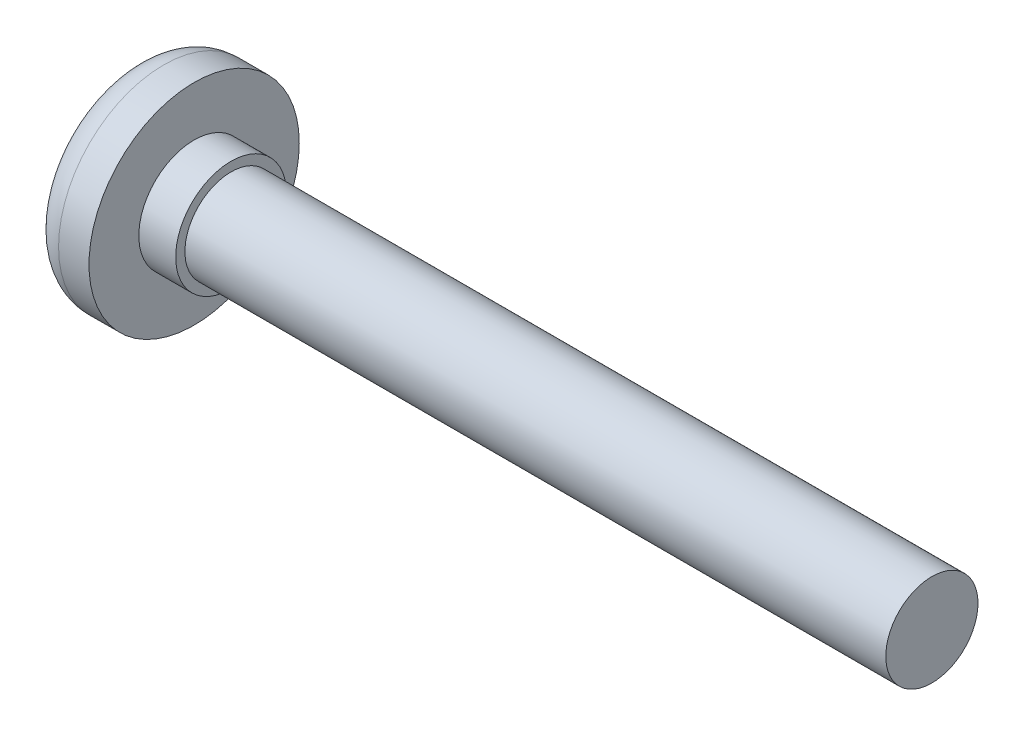
from build123d import *

# Parameters (mm, degrees)
EXTRUDE1_DEPTH    = 1
FILLET1_R         = 0.825
FILLET2_R         = 0.162857143
SKETCH3_OUTSIDE_W = 12.32
SKETCH3_OUTSIDE_H = 12.32
SKETCH3_OUTSIDE_R = 1.25
SIS_KIERRE_DEPTH  = 19


with BuildPart() as part:
    # Sketch1 → Revolve1 (revolve)
    with BuildSketch(Plane.XY, mode=Mode.PRIVATE) as revolve1_sk:
        Polygon((-20, 2.85), (-21.65, 2.85), (-21.65, 0), (0, 0), (0, 1.5), (-20, 1.5), align=None)
    revolve(revolve1_sk.sketch.rotate(Axis((22.773389601, 0, 0), (-1, 0, 0)), 90), axis=Axis((22.773389601, 0, 0), (-1, 0, 0)))

    # Sketch2 → Extrude1 (cut)
    with BuildSketch(Plane.ZY.offset(21.65)):
        with BuildLine():
            ThreePointArc((-1.4, 0), (-0.761857658, 0.439858724), (-0.7, 1.212435565))
            ThreePointArc((-0.7, 1.212435565), (0, 0.879717448), (0.7, 1.212435565))
            ThreePointArc((0.7, 1.212435565), (0.761857658, 0.439858724), (1.4, 0))
            ThreePointArc((1.4, 0), (0.761857658, -0.439858724), (0.7, -1.212435565))
            ThreePointArc((0.7, -1.212435565), (0, -0.879717448), (-0.7, -1.212435565))
            ThreePointArc((-0.7, -1.212435565), (-0.761857658, -0.439858724), (-1.4, 0))
        make_face()
    extrude(amount=-EXTRUDE1_DEPTH, mode=Mode.SUBTRACT)

    # Fillet1
    fillet1_edges = [part.edges().sort_by_distance(p)[0] for p in [
        (-21.65, 0, 2.85),
    ]]
    fillet(fillet1_edges, radius=FILLET1_R)

    # Fillet2
    fillet2_edges = [part.edges().sort_by_distance(p)[0] for p in [
        (-21.15, 0, -1.4),
        (-21.15, 1.212435565, -0.7),
        (-21.15, 1.212435565, 0.7),
        (-21.15, 0, 1.4),
        (-21.15, -1.212435565, 0.7),
        (-21.15, -1.212435565, -0.7),
    ]]
    fillet(fillet2_edges, radius=FILLET2_R)

    # Sketch3 outside → Sisäkierre (cut)
    with BuildSketch(Plane(origin=(0, 0, 0), x_dir=(0, 0, -1), z_dir=(1, 0, 0))):
        Rectangle(SKETCH3_OUTSIDE_W, SKETCH3_OUTSIDE_H)
        Circle(SKETCH3_OUTSIDE_R, mode=Mode.SUBTRACT)
    extrude(amount=-SIS_KIERRE_DEPTH, mode=Mode.SUBTRACT)


solid = part.part
